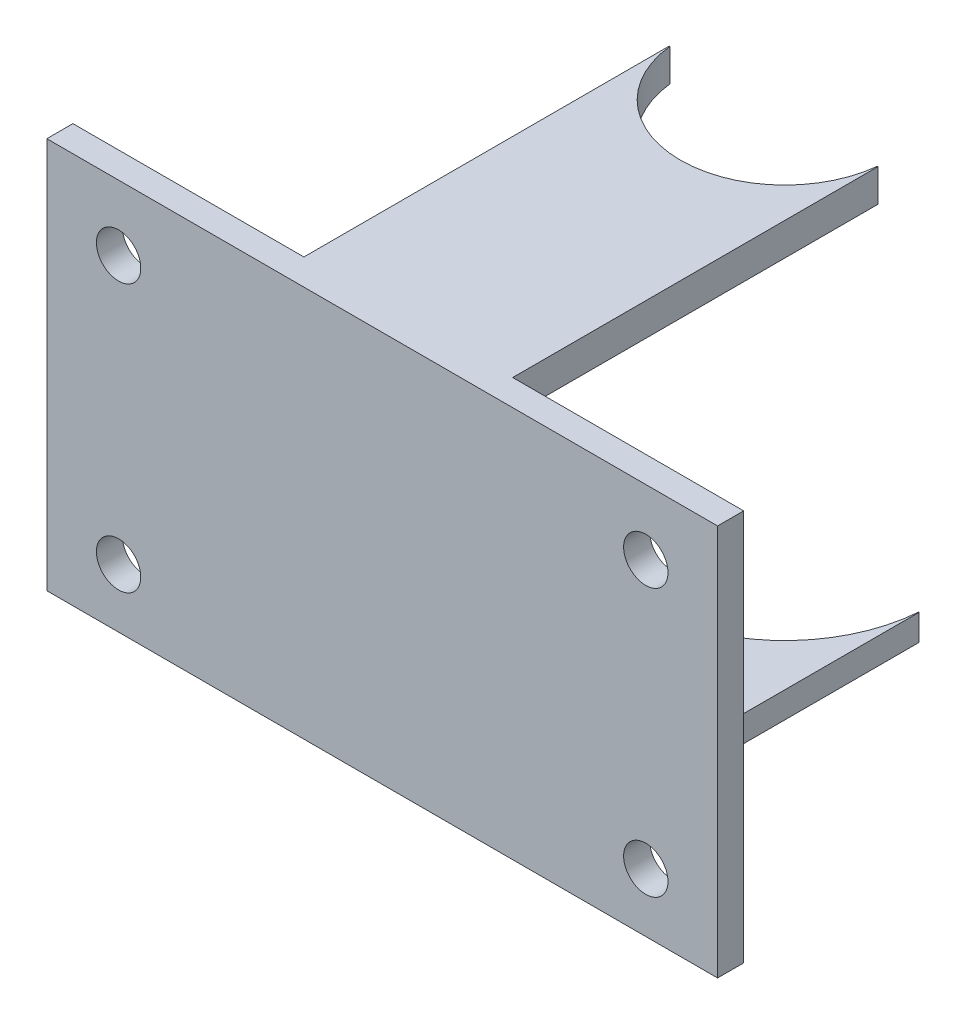
from build123d import *

# Parameters (mm, degrees)
SKETCH1_W           = 51.4
SKETCH1_H           = 30
BOSS_EXTRUDE1_DEPTH = 2
SKETCH2_R           = 1.7
CUT_EXTRUDE1_DEPTH  = 15
SKETCH3_W           = 16
SKETCH3_H           = 2.5
SKETCH3_W_2         = 22.3
SKETCH3_H_2         = 2
BOSS_EXTRUDE2_DEPTH = 28
SKETCH4_R           = 8
CUT_EXTRUDE3_DEPTH  = 10
SKETCH6_R           = 11.15
CUT_EXTRUDE4_DEPTH  = 10


with BuildPart() as part:
    # Sketch1 → Boss-Extrude1 (new body)
    with BuildSketch(Plane.XY):
        with Locations((25.7, 15)):
            Rectangle(SKETCH1_W, SKETCH1_H)
    extrude(amount=BOSS_EXTRUDE1_DEPTH)

    # Sketch2 → Cut-Extrude1 (cut)
    with BuildSketch(Plane(origin=(0, 0, 0), x_dir=(-1, 0, 0), z_dir=(0, 0, -1))):
        with Locations((-45.9, 25)):
            Circle(SKETCH2_R)
        with Locations((-5.5, 25)):
            Circle(SKETCH2_R)
        with Locations((-5.5, 4.5)):
            Circle(SKETCH2_R)
        with Locations((-45.9, 4.5)):
            Circle(SKETCH2_R)
    extrude(amount=-CUT_EXTRUDE1_DEPTH, mode=Mode.SUBTRACT)

    # Sketch3 → Boss-Extrude2 (add)
    with BuildSketch(Plane(origin=(0, 0, 0), x_dir=(-1, 0, 0), z_dir=(0, 0, -1))):
        with Locations((-25.7, 28.75)):
            Rectangle(SKETCH3_W, SKETCH3_H)
        with Locations((-25.7, 1)):
            Rectangle(SKETCH3_W_2, SKETCH3_H_2)
    extrude(amount=BOSS_EXTRUDE2_DEPTH)

    # Sketch4 → Cut-Extrude3 (cut)
    with BuildSketch(Plane(origin=(0, 30, 0), x_dir=(1, 0, 0), z_dir=(0, 1, 0))):
        with Locations((25.7, 28.85)):
            Circle(SKETCH4_R)
    extrude(amount=-CUT_EXTRUDE3_DEPTH, mode=Mode.SUBTRACT)

    # Sketch6 → Cut-Extrude4 (cut)
    with BuildSketch(Plane(origin=(0, 2, 0), x_dir=(1, 0, 0), z_dir=(0, 1, 0))):
        with Locations((25.7, 28.85)):
            Circle(SKETCH6_R)
    extrude(amount=-CUT_EXTRUDE4_DEPTH, mode=Mode.SUBTRACT)


solid = part.part
